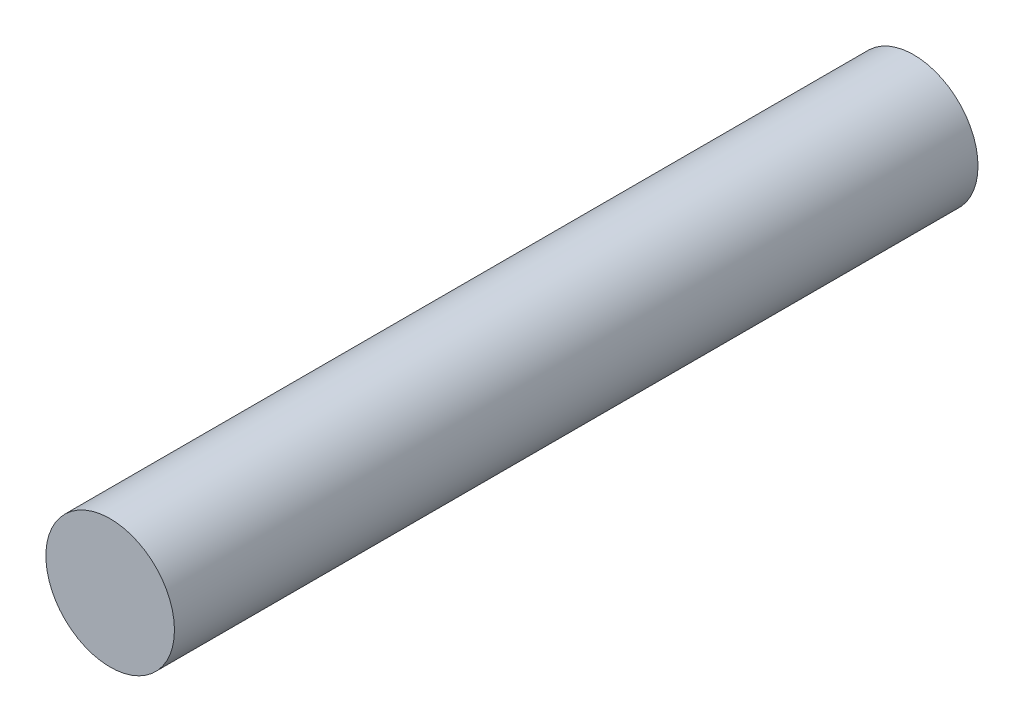
from build123d import *

# Parameters (mm, degrees)
SKETCH1_R           = 8
BOSS_EXTRUDE1_DEPTH = 100


with BuildPart() as part:
    # Sketch1 → Boss-Extrude1 (new body)
    with BuildSketch(Plane.XY):
        Circle(SKETCH1_R)
    extrude(amount=BOSS_EXTRUDE1_DEPTH)


solid = part.part
